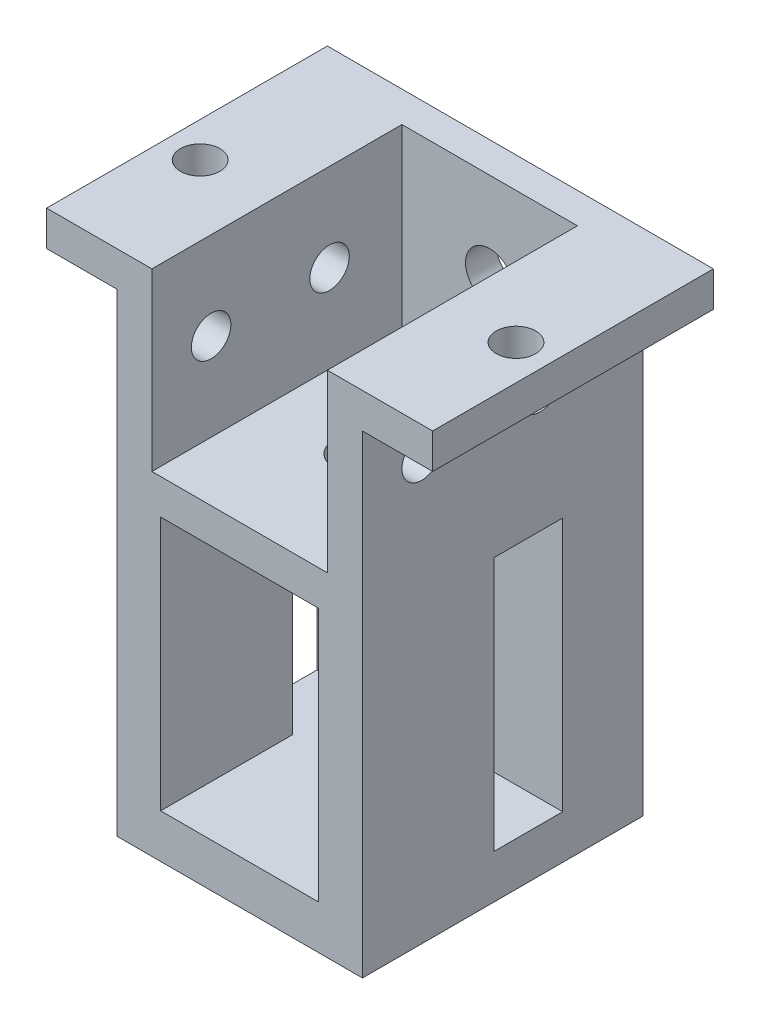
from build123d import *

# Parameters (mm, degrees)
BOSS_EXTRUDE1_DEPTH = 27
SKETCH2_R           = 2.25
CUT_EXTRUDE1_DEPTH  = 52
SKETCH3_R           = 2.25
CUT_EXTRUDE2_DEPTH  = 41.162171256
SKETCH5_W           = 28
SKETCH5_H           = 4.176671075
BOSS_EXTRUDE2_DEPTH = 34
SKETCH6_W           = 28
SKETCH6_H           = 5
BOSS_EXTRUDE3_DEPTH = 22.823328925
SKETCH7_R           = 2.75
CUT_EXTRUDE3_DEPTH  = 68.653529103
BOSS_EXTRUDE4_REACH = 50.672
SKETCH8_W           = 5
SKETCH8_H           = 15
SKETCH9_R           = 2.75
BOSS_EXTRUDE5_DEPTH = 5
SKETCH10_W          = 20
SKETCH10_H          = 20
CUT_EXTRUDE4_DEPTH  = 1.5


with BuildPart() as part:
    # Sketch1 → Boss-Extrude1 (new body)
    with BuildSketch(Plane.XY):
        Polygon((-14, 0), (14, 0), (14, 20), (22, 20), (22, 24), (10, 24), (10, 4), (-10, 4), (-10, 24), (-22, 24), (-22, 20), (-14, 20), align=None)
    extrude(amount=BOSS_EXTRUDE1_DEPTH)

    # Sketch2 → Cut-Extrude1 (cut, through all)
    with BuildSketch(Plane.ZY.offset(14)):
        with Locations(Location((6.75, 14, 0), (0, 0, 270))):
            Circle(SKETCH2_R)
        with Locations(Location((20.25, 14, 0), (0, 0, 270))):
            Circle(SKETCH2_R)
    extrude(amount=-CUT_EXTRUDE1_DEPTH, mode=Mode.SUBTRACT)

    # Sketch3 → Cut-Extrude2 (cut, through all)
    with BuildSketch(Plane.XZ.offset(-20)):
        with Locations(Location((-18, 13.5, 0), (0, 0, 270))):
            Circle(SKETCH3_R)
        with Locations(Location((18, 13.5, 0), (0, 0, 270))):
            Circle(SKETCH3_R)
    extrude(amount=-CUT_EXTRUDE2_DEPTH, mode=Mode.SUBTRACT)

    # Sketch5 → Boss-Extrude2 (add)
    with BuildSketch(Plane.XZ):
        with Locations((0, 2.088335538)):
            Rectangle(SKETCH5_W, SKETCH5_H)
    extrude(amount=BOSS_EXTRUDE2_DEPTH)

    # Sketch6 → Boss-Extrude3 (add)
    with BuildSketch(Plane.XY.offset(4.176671075)):
        with Locations((0, -31.5)):
            Rectangle(SKETCH6_W, SKETCH6_H)
    extrude(amount=BOSS_EXTRUDE3_DEPTH)

    # Sketch7 → Cut-Extrude3 (cut, through all)
    with BuildSketch(Plane.XZ.offset(34)):
        with Locations(Location((0, 13.5, 0), (0, 0, 270))):
            Circle(SKETCH7_R)
    extrude(amount=-CUT_EXTRUDE3_DEPTH, mode=Mode.SUBTRACT)

    # Sketch8 → Boss-Extrude4 (add, up to next)
    with BuildSketch(Plane.XZ, mode=Mode.PRIVATE) as boss_extrude4_sk1:
        with Locations((11.5, 19.5)):
            Rectangle(SKETCH8_W, SKETCH8_H)
    boss_extrude4_tool1 = extrude(boss_extrude4_sk1.sketch, amount=BOSS_EXTRUDE4_REACH, mode=Mode.PRIVATE) - part.part
    # Sketch8 → Boss-Extrude4 (add, up to next)
    with BuildSketch(Plane.XZ, mode=Mode.PRIVATE) as boss_extrude4_sk2:
        with Locations((-11.5, 19.5)):
            Rectangle(SKETCH8_W, SKETCH8_H)
    boss_extrude4_tool2 = extrude(boss_extrude4_sk2.sketch, amount=BOSS_EXTRUDE4_REACH, mode=Mode.PRIVATE) - part.part
    add(boss_extrude4_tool1.solids().sort_by_distance((11.5, 0, 19.5))[0])
    add(boss_extrude4_tool2.solids().sort_by_distance((-11.5, 0, 19.5))[0])

    # Sketch9 → Boss-Extrude5 (add)
    with BuildSketch(Plane(origin=(0, 0, 0), x_dir=(-1, 0, 0), z_dir=(0, 0, -1))):
        Polygon((-14, -34), (14, -34), (14, 20), (22, 20), (22, 24), (-22, 24), (-22, 20), (-14, 20), align=None)
        with Locations((0, 14)):
            Circle(SKETCH9_R, mode=Mode.SUBTRACT)
    extrude(amount=BOSS_EXTRUDE5_DEPTH)

    # Sketch10 → Cut-Extrude4 (cut)
    with BuildSketch(Plane.XY):
        with Locations((0, 14)):
            Rectangle(SKETCH10_W, SKETCH10_H)
    extrude(amount=-CUT_EXTRUDE4_DEPTH, mode=Mode.SUBTRACT)


solid = part.part
